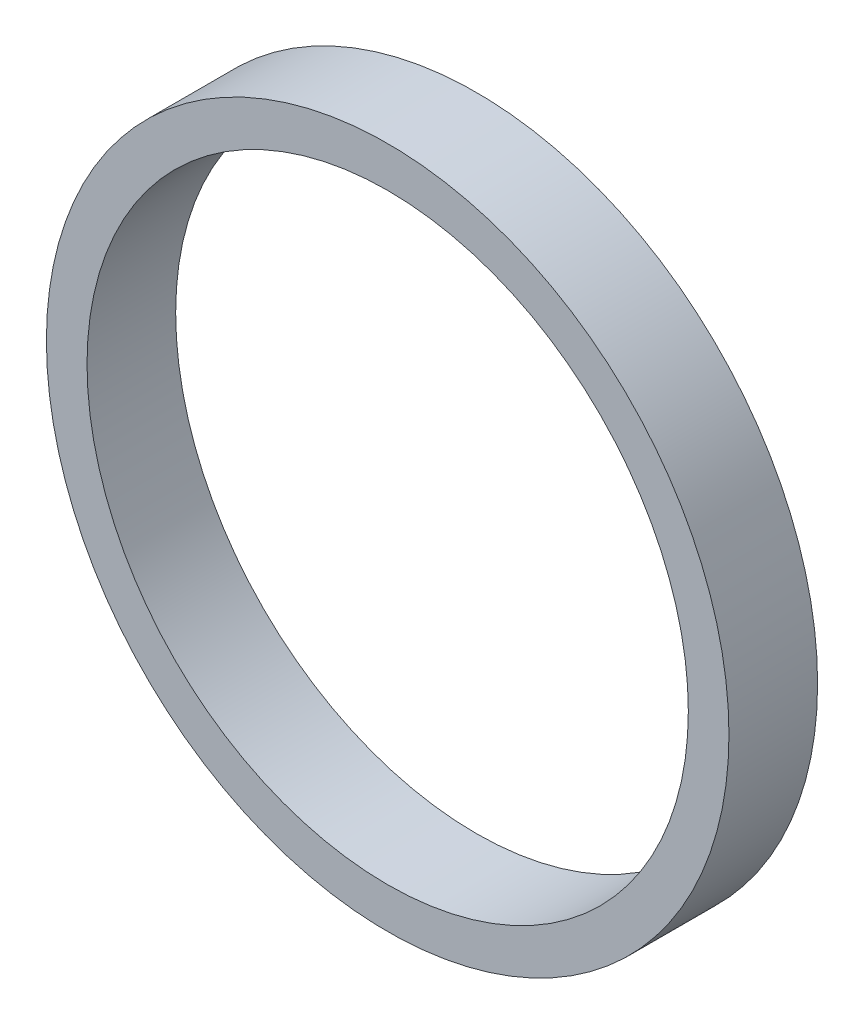
from build123d import *

# Parameters (mm, degrees)
SKETCH1_R           = 5.775
SKETCH1_R_2         = 5.0875
BOSS_EXTRUDE1_DEPTH = 1.5


with BuildPart() as part:
    # Sketch1 → Boss-Extrude1 (new body)
    with BuildSketch(Plane.XY):
        Circle(SKETCH1_R)
        Circle(SKETCH1_R_2, mode=Mode.SUBTRACT)
    extrude(amount=BOSS_EXTRUDE1_DEPTH)


solid = part.part
